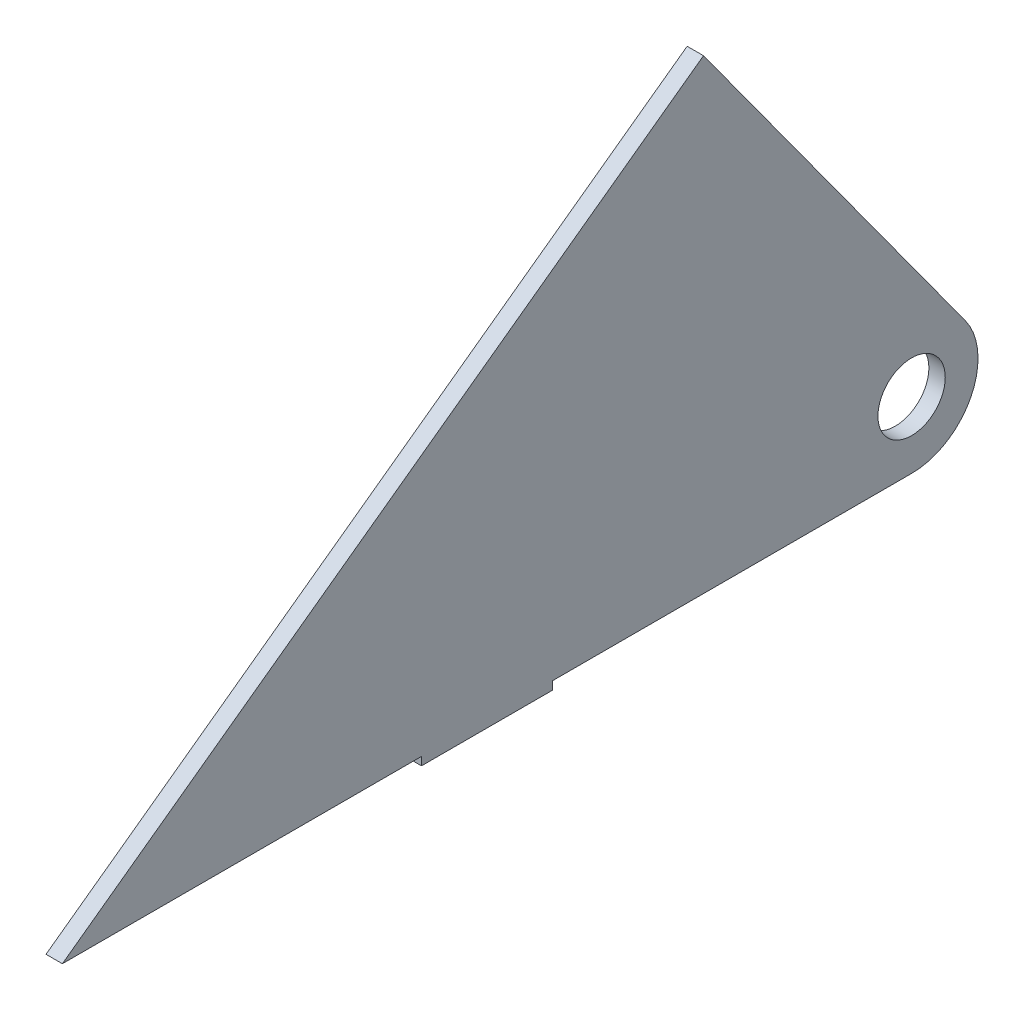
from build123d import *

# Parameters (mm, degrees)
SKETCH1_R           = 3.2639
BOSS_EXTRUDE1_DEPTH = 0.79375


with BuildPart() as part:
    # Sketch1 → Boss-Extrude1 (new, symmetric)
    with BuildSketch(Plane(origin=(0, 0, 0), x_dir=(0, 0, -1), z_dir=(1, 0, 0))):
        with BuildLine():
            Line((-20.171387669, 38.718044278), (-82.324589357, -6.4389))
            Line((-82.324589357, -6.4389), (-47.512294679, -6.4389))
            Line((-47.512294679, -6.4389), (-47.512294679, -7.23265))
            Line((-47.512294679, -7.23265), (-34.812294679, -7.23265))
            Line((-34.812294679, -7.23265), (-34.812294679, -6.4389))
            Line((-34.812294679, -6.4389), (0, -6.4389))
            ThreePointArc((0, -6.4389), (5.737101909, -2.923199429), (5.209179525, 3.784690461))
            Line((5.209179525, 3.784690461), (-20.171387669, 38.718044278))
        make_face()
        Circle(SKETCH1_R, mode=Mode.SUBTRACT)
    extrude(amount=BOSS_EXTRUDE1_DEPTH, both=True)


solid = part.part
